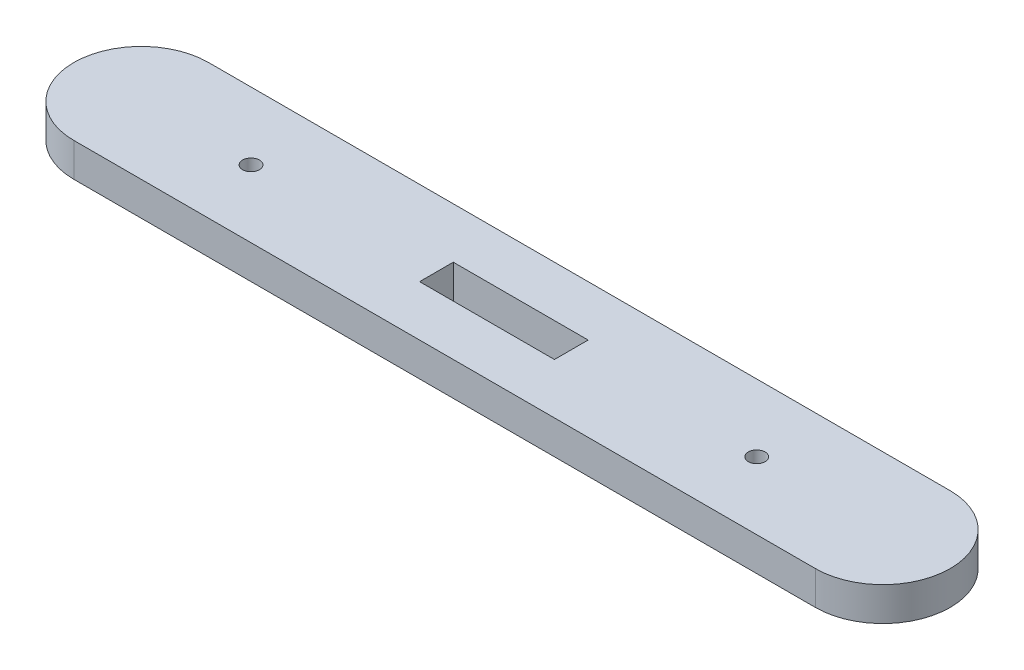
from build123d import *

# Parameters (mm, degrees)
SKETCH1_R           = 1.5875
SKETCH1_W           = 25.4
SKETCH1_H           = 6.35
BOSS_EXTRUDE1_DEPTH = 6.35


with BuildPart() as part:
    # Sketch1 → Boss-Extrude1 (new body)
    with BuildSketch(Plane(origin=(0, 0, 0), x_dir=(1, 0, 0), z_dir=(0, 1, 0))):
        with BuildLine():
            Line((72.335187692, -24.125963073), (-67.364812308, -24.125963073))
            ThreePointArc((-67.364812308, -24.125963073), (-80.064812308, -36.825963073), (-67.364812308, -49.525963073))
            Line((-67.364812308, -49.525963073), (72.335187692, -49.525963073))
            ThreePointArc((72.335187692, -49.525963073), (85.035187692, -36.825963073), (72.335187692, -24.125963073))
        make_face()
        with Locations(Location((-46.672412507, -36.825963073, 0), (0, 0, 270))):
            Circle(SKETCH1_R, mode=Mode.SUBTRACT)
        with Locations(Location((48.577587493, -36.825963073, 0), (0, 0, 270))):
            Circle(SKETCH1_R, mode=Mode.SUBTRACT)
        with Locations((0.952587493, -36.825963073)):
            Rectangle(SKETCH1_W, SKETCH1_H, mode=Mode.SUBTRACT)
    extrude(amount=BOSS_EXTRUDE1_DEPTH)


solid = part.part
